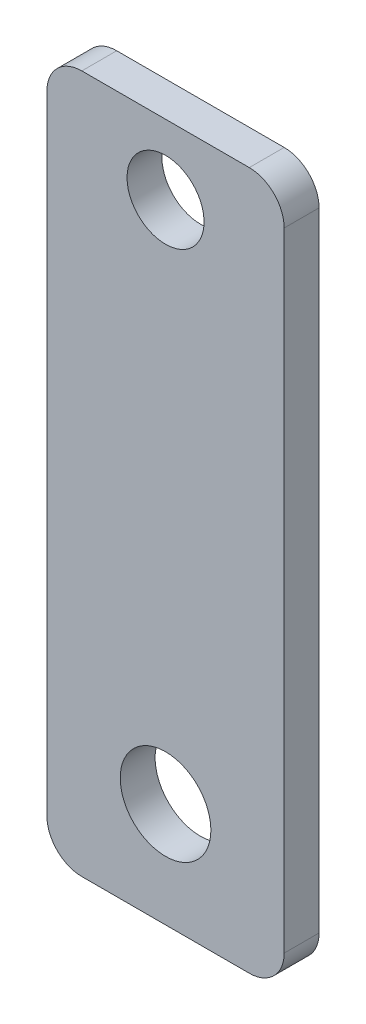
from build123d import *

# Parameters (mm, degrees)
SKETCH1_W           = 21.59
SKETCH1_H           = 63.5
SKETCH1_R           = 4.124999878
SKETCH1_R_2         = 3.5052
BOSS_EXTRUDE1_DEPTH = 3.175
FILLET1_R           = 3.175


with BuildPart() as part:
    # Sketch1 → Boss-Extrude1 (new body)
    with BuildSketch(Plane.XY):
        with Locations((10.795, 31.75)):
            Rectangle(SKETCH1_W, SKETCH1_H)
        with Locations((10.795, 9.525)):
            Circle(SKETCH1_R, mode=Mode.SUBTRACT)
        with Locations(Location((10.795, 57.15, 0), (0, 0, 180))):
            Circle(SKETCH1_R_2, mode=Mode.SUBTRACT)
    extrude(amount=BOSS_EXTRUDE1_DEPTH)

    # Fillet1
    fillet1_edges = [part.edges().sort_by_distance(p)[0] for p in [
        (0, 0, 1.5875),
        (21.59, 0, 1.5875),
        (21.59, 63.5, 1.5875),
        (0, 63.5, 1.5875),
    ]]
    fillet(fillet1_edges, radius=FILLET1_R)


solid = part.part
